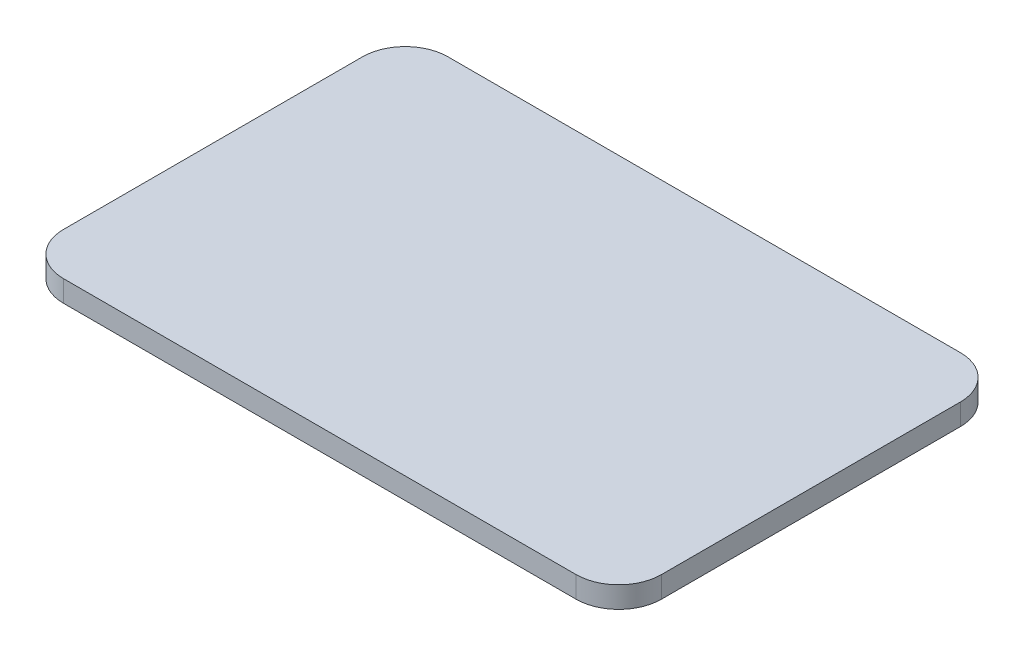
from build123d import *

# Parameters (mm, degrees)
SKETCH1_W           = 140
SKETCH1_H           = 90
BOSS_EXTRUDE1_DEPTH = 5
FILLET1_R           = 10


with BuildPart() as part:
    # Sketch1 → Boss-Extrude1 (new body)
    with BuildSketch(Plane(origin=(0, 0, 0), x_dir=(1, 0, 0), z_dir=(0, 1, 0))):
        with Locations((19.862448418, 6.066024759)):
            Rectangle(SKETCH1_W, SKETCH1_H)
    extrude(amount=BOSS_EXTRUDE1_DEPTH)

    # Fillet1
    fillet1_edges = [part.edges().sort_by_distance(p)[0] for p in [
        (-50.137551582, 2.5, -51.066024759),
        (89.862448418, 2.5, -51.066024759),
        (89.862448418, 2.5, 38.933975241),
        (-50.137551582, 2.5, 38.933975241),
    ]]
    fillet(fillet1_edges, radius=FILLET1_R)


solid = part.part
